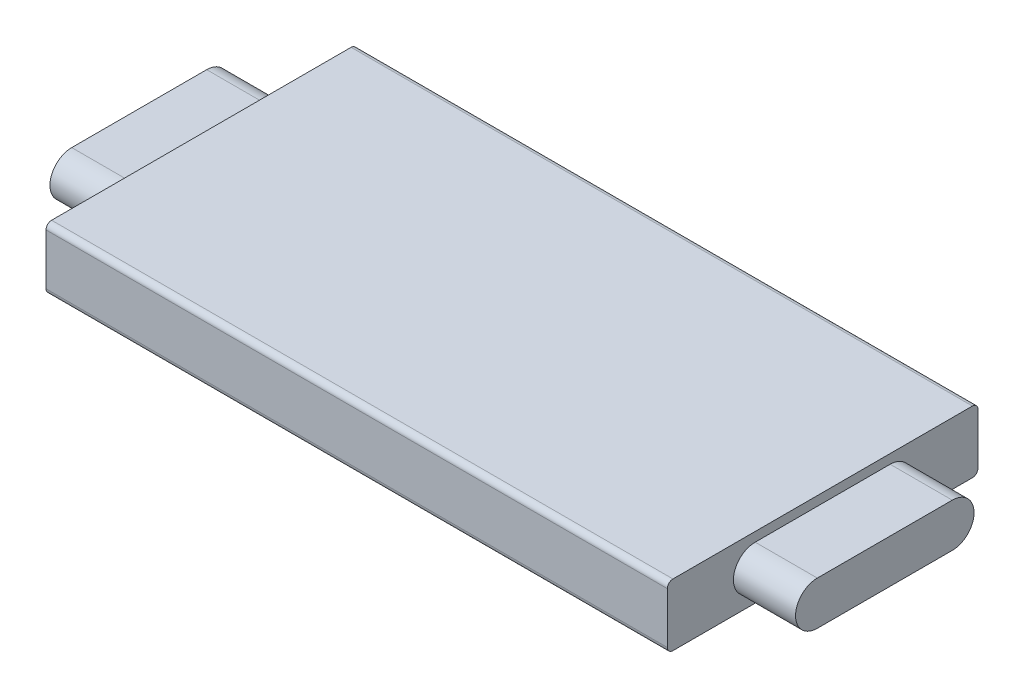
from build123d import *

# Parameters (mm, degrees)
SKETCH1_W                = 25.4
SKETCH1_H                = 12.7
BOSS_EXTRUDE1_DEPTH      = 1.27
FILLET1_R                = 0.2286
BOSS_EXTRUDE2_DEPTH      = 15.24
BOSS_EXTRUDE2_DEPTH_BACK = 15.24


with BuildPart() as part:
    # Sketch1 → Boss-Extrude1 (new, symmetric)
    with BuildSketch(Plane(origin=(0, 0, 0), x_dir=(1, 0, 0), z_dir=(0, 1, 0))):
        Rectangle(SKETCH1_W, SKETCH1_H)
    extrude(amount=BOSS_EXTRUDE1_DEPTH, both=True)

    # Fillet1
    fillet1_edges = [part.edges().sort_by_distance(p)[0] for p in [
        (0, 1.27, 6.35),
        (0, -1.27, 6.35),
        (0, -1.27, -6.35),
        (0, 1.27, -6.35),
    ]]
    fillet(fillet1_edges, radius=FILLET1_R)

    # Sketch3 → Boss-Extrude2 (add, two sides: drawn at the far end of the back side and taken through both)
    with BuildSketch(Plane(origin=(0, 0, 0), x_dir=(0, 0, -1), z_dir=(1, 0, 0)).offset(-BOSS_EXTRUDE2_DEPTH_BACK)):
        with BuildLine():
            Line((-2.75846638, 0.890155409), (2.75846638, 0.890155409))
            ThreePointArc((2.75846638, 0.890155409), (3.648621789, 0), (2.75846638, -0.890155409))
            Line((2.75846638, -0.890155409), (-2.75846638, -0.890155409))
            ThreePointArc((-2.75846638, -0.890155409), (-3.648621789, 0), (-2.75846638, 0.890155409))
        make_face()
    extrude(amount=BOSS_EXTRUDE2_DEPTH + BOSS_EXTRUDE2_DEPTH_BACK)


solid = part.part
